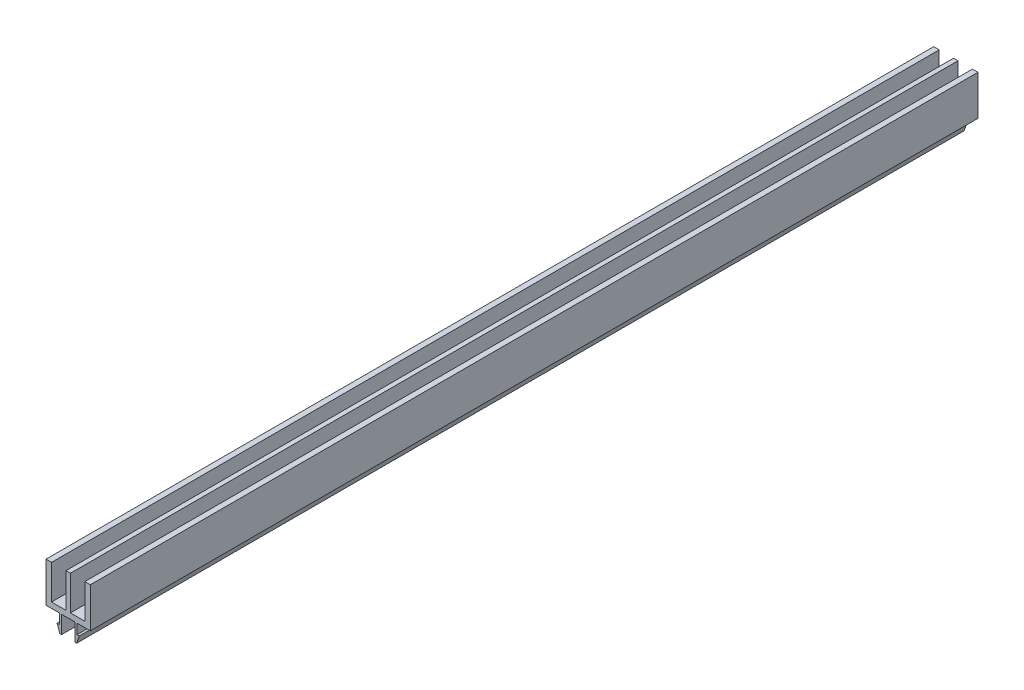
from build123d import *

# Parameters (mm, degrees)
BOSS_EXTRU_1_DEPTH = 400.29


with BuildPart() as part:
    # Esquisse1 → Boss.-Extru.1 (new body)
    with BuildSketch(Plane.XY.offset(50)):
        Polygon((-1, 2.5), (-7.5, 2.5), (-7.5, 17.999999998), (-10, 17.999999998), (-10, 0), (-4, 0), (-4, -4.5), (-5, -4.5), (-3.75, -8), (-3, -8), (-3, 0), (3, 0), (3, -8), (3.75, -8), (5, -4.5), (4, -4.5), (4, 0), (10, 0), (10, 17.999999998), (7.5, 17.999999998), (7.5, 2.5), (1, 2.5), (1, 17.999999998), (-1, 17.999999998), align=None)
    extrude(amount=-BOSS_EXTRU_1_DEPTH)


solid = part.part
